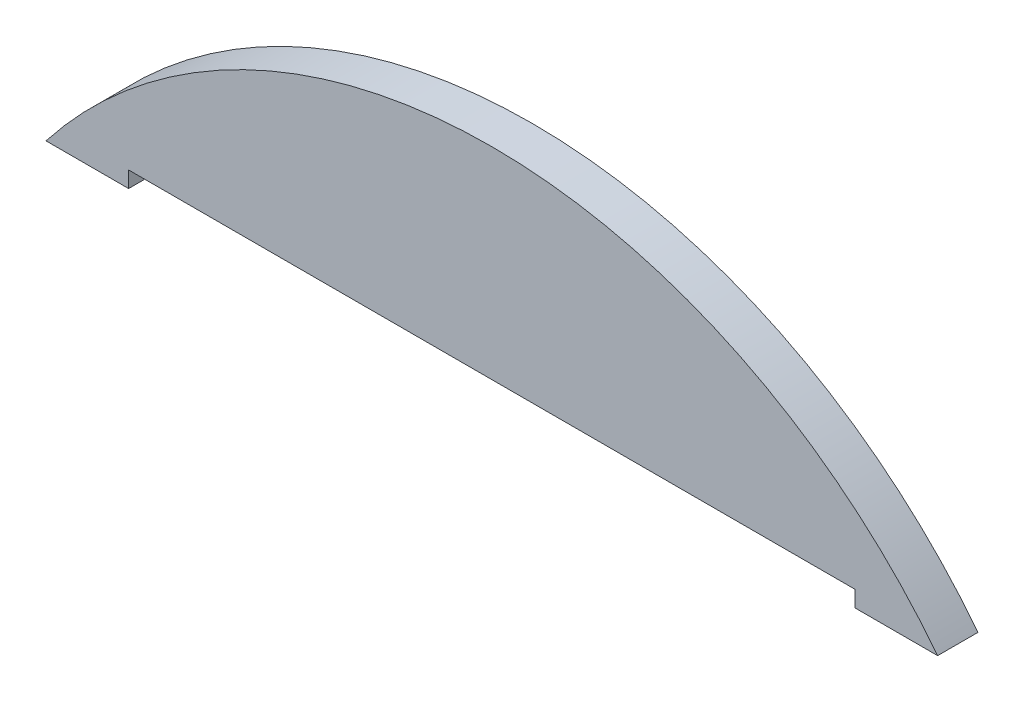
from build123d import *

# Parameters (mm, degrees)
ESQUISSE1_R             = 175
ESQUISSE1_W             = 90
ESQUISSE1_H             = 90
BOSS_EXTRU_1_DEPTH      = 5
ENL_V_START             = -10
ENL_V_MAT_EXTRU_1_DEPTH = 10
ENL_V_MAT_EXTRU_4_DEPTH = 10


with BuildPart() as part:
    # Esquisse1 → Boss.-Extru.1 (new body)
    with BuildSketch(Plane.XY):
        Circle(ESQUISSE1_R)
        Rectangle(ESQUISSE1_W, ESQUISSE1_H, mode=Mode.SUBTRACT)
    extrude(amount=BOSS_EXTRU_1_DEPTH)

    # Esquisse2 → Enlèv. mat.-Extru.1 (cut)
    with BuildSketch(Plane.XY.offset(5).offset(ENL_V_START)):
        with BuildLine():
            Line((-156.468184794, 78.375424383), (-90, 40))
            Line((-90, 40), (-90, -40))
            Line((-90, -40), (-156.468184794, -78.375424383))
            ThreePointArc((-156.468184794, -78.375424383), (-175, 0), (-156.468184794, 78.375424383))
        make_face()
    extrude(amount=ENL_V_MAT_EXTRU_1_DEPTH, mode=Mode.SUBTRACT)

    # Esquisse3 → Enlèv. mat.-Extru.4 (cut)
    with BuildSketch(Plane.XY.offset(5).offset(ENL_V_START)):
        with BuildLine():
            Line((-156.468184794, 78.375424383), (-95.196152423, 43))
            Line((-95.196152423, 43), (-200, 43))
            Line((-200, 43), (-200, -207))
            Line((-200, -207), (200, -207))
            Line((200, -207), (200, 43))
            Line((200, 43), (169.634902069, 43))
            ThreePointArc((169.634902069, 43), (18.873149539, 173.979321261), (-156.468184794, 78.375424383))
        make_face()
        with BuildLine():
            Line((-55.235857919, 43), (55.235857919, 43))
            ThreePointArc((55.235857919, 43), (0, 70), (-55.235857919, 43))
        make_face(mode=Mode.SUBTRACT)
    extrude(amount=ENL_V_MAT_EXTRU_4_DEPTH, mode=Mode.SUBTRACT)


solid = part.part
